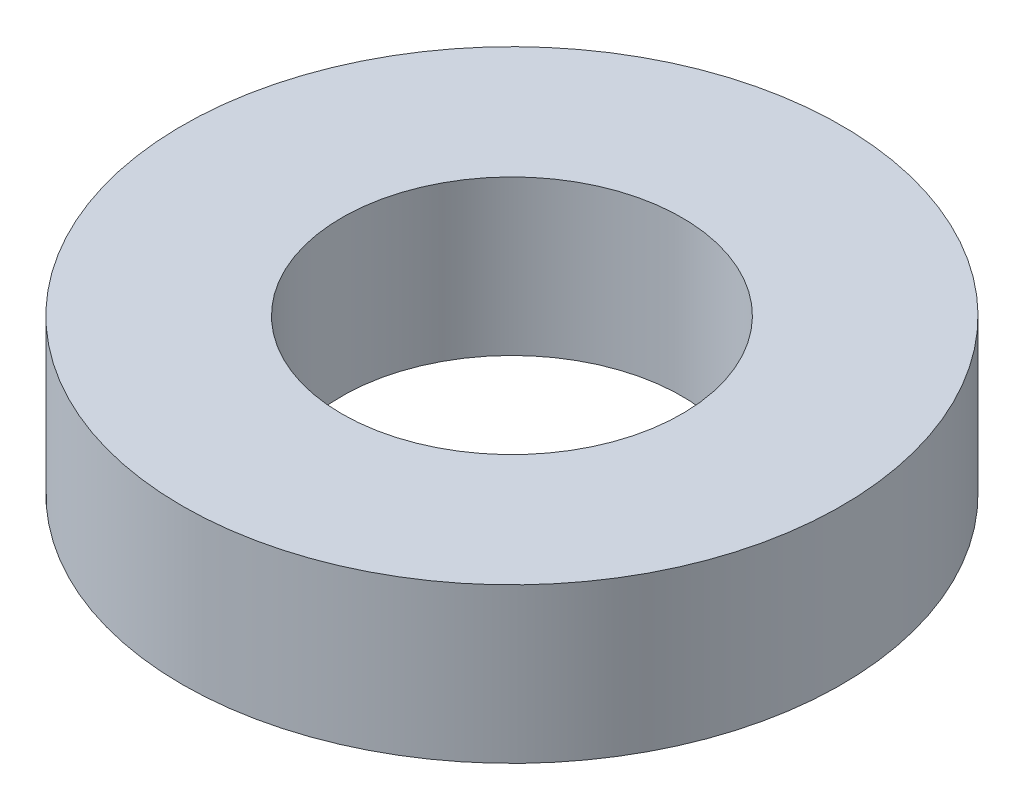
from build123d import *

# Parameters (mm, degrees)
SKETCH1_R           = 6.35
SKETCH1_R_2         = 3.2766
BOSS_EXTRUDE1_DEPTH = 2.97942


with BuildPart() as part:
    # Sketch1 → Boss-Extrude1 (new body)
    with BuildSketch(Plane(origin=(0, 0, 0), x_dir=(1, 0, 0), z_dir=(0, 1, 0))):
        with Locations(Location((0, 0, 0), (0, 0, 270))):
            Circle(SKETCH1_R)
        with Locations(Location((0, 0, 0), (0, 0, 270))):
            Circle(SKETCH1_R_2, mode=Mode.SUBTRACT)
    extrude(amount=BOSS_EXTRUDE1_DEPTH)


solid = part.part
